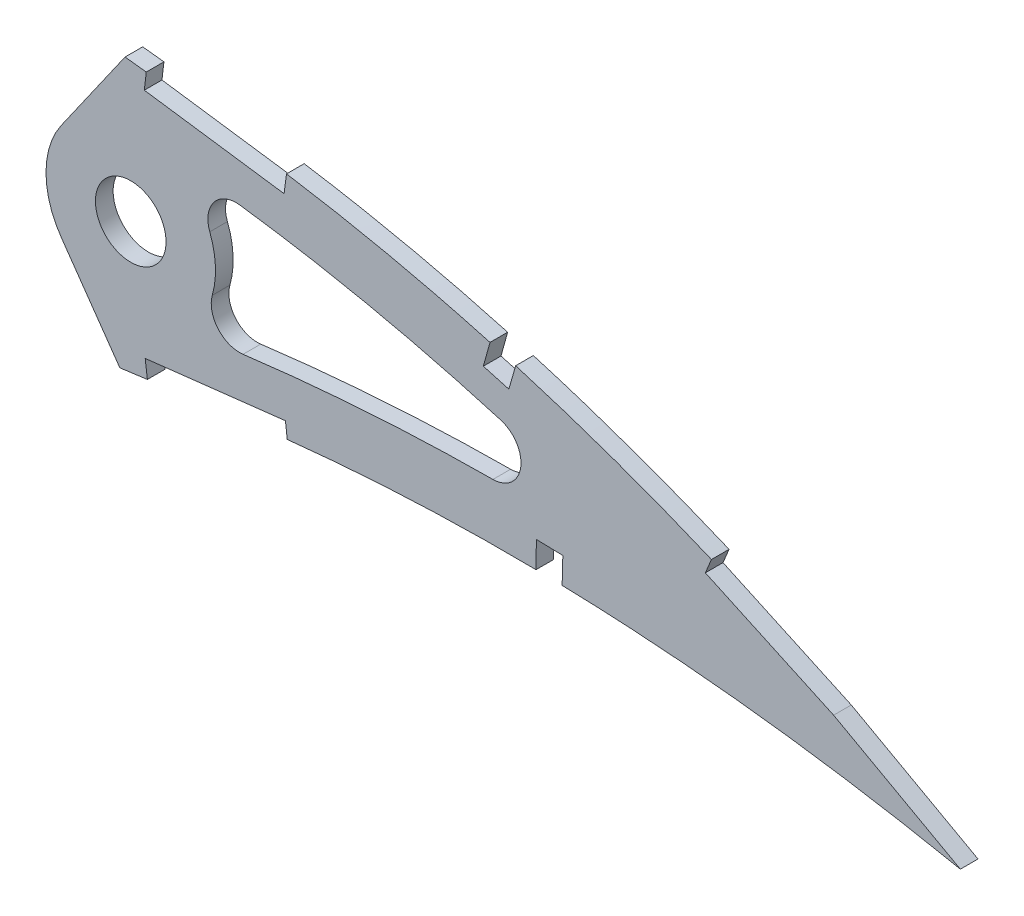
from build123d import *

# Parameters (mm, degrees)
BOSS_EXTRUDE1_DEPTH     = 3.175
SKETCH3_R               = 6.35
CUT_EXTRUDE2_DEPTH      = 7.62
CUT_EXTRUDE3_DEPTH      = 460.680430564
CUT_EXTRUDE3_DEPTH_BACK = 460.680430564
CUT_EXTRUDE4_DEPTH      = 459.987889409
FILLET1_R               = 5.08


with BuildPart() as part:
    # Sketch1 → Boss-Extrude1 (new body)
    with BuildSketch(Plane.XY):
        with BuildLine():
            Line((452.103130844, 0.704841059), (456.093968789, -1.676407199))
            Line((456.093968789, -1.676407199), (451.539257956, -0.704841059))
            add(Edge.make_bspline(
                [(0, 0), (0.116098484, -0.548062271), (0.348829019, -1.646705608), (0.981127511, -3.228296827), (1.817312083, -4.748664111), (2.874932324, -6.203769023), (4.146956076, -7.593213852), (5.630573928, -8.918443806), (7.324330898, -10.17874635), (9.226010202, -11.373547856), (11.332849305, -12.504116729), (13.642480166, -13.569749989), (16.152796843, -14.570114683), (18.861064307, -15.503873502), (21.763971588, -16.372448625), (24.858758771, -17.173723352), (28.141906776, -17.908817596), (31.610257831, -18.575854993), (35.260032504, -19.175513209), (39.087439203, -19.707456616), (43.088549366, -20.172017908), (47.259437594, -20.568222339), (51.595978462, -20.896922095), (56.093849686, -21.158335191), (60.748685259, -21.353290574), (65.556026339, -21.481047186), (70.511164689, -21.543596642), (75.60962225, -21.541878079), (80.846411515, -21.475431763), (86.217059019, -21.347928406), (91.716411041, -21.158560481), (97.339502767, -20.909619435), (103.081262098, -20.60361064), (108.936539298, -20.241571378), (114.900181528, -19.825106256), (120.967010704, -19.35755507), (127.131515672, -18.84008407), (133.388320155, -18.27570942), (139.73188498, -17.667256592), (146.156729407, -17.016651105), (152.657182369, -16.326953548), (159.227454029, -15.600398833), (165.861955098, -14.840863119), (172.554624992, -14.049720613), (179.299804335, -13.231488425), (186.0911476, -12.387729793), (192.922975871, -11.521694689), (199.789144556, -10.637460813), (206.683225759, -9.734927313), (213.599421065, -8.820524357), (220.53106073, -7.893498895), (227.472111233, -6.958618548), (234.416147314, -6.018789286), (241.356405409, -5.07430035), (248.28678484, -4.129065861), (255.200856388, -3.185680808), (262.091847615, -2.244231265), (268.953524037, -1.309396646), (275.778976202, -0.38106275), (282.561910312, 0.538888344), (289.295826346, 1.447710664), (295.974371147, 2.344257157), (302.590655451, 3.227960607), (309.138022785, 4.099152889), (315.511866205, 4.931391047), (321.69553077, 5.768992271), (327.709854245, 6.4556395), (333.649291775, 7.04171769), (339.520012945, 7.522220911), (345.31496828, 7.904062197), (351.027518107, 8.189969928), (356.650854245, 8.383935735), (362.17787359, 8.491713952), (367.601672755, 8.516039607), (372.914848341, 8.464670411), (378.110490176, 8.34174704), (383.181346836, 8.152787103), (388.120344083, 7.904165623), (392.920466429, 7.60266025), (397.574507523, 7.252718477), (402.075982121, 6.8625098), (406.417945063, 6.437746476), (410.593729281, 5.983281443), (414.597241701, 5.508637621), (418.422074216, 5.016940024), (422.062473684, 4.516268978), (425.512580015, 4.011698392), (428.766929364, 3.509669922), (431.820408455, 3.014973074), (434.668085107, 2.534173613), (437.305498365, 2.071763811), (439.728071725, 1.632259415), (441.932444373, 1.221205742), (443.914262697, 0.840644737), (445.670876088, 0.49684807), (447.199018295, 0.19133282), (448.496449148, -0.071596745), (449.560902928, -0.290902855), (450.390762879, -0.462985534), (450.984389878, -0.5881196), (451.34114184, -0.662580877), (451.499651332, -0.696392563), (451.539257956, -0.704841059)],
                knots=[0, 0, 0, 0, 0.003638255, 0.007293231, 0.011028136, 0.014901081, 0.018963272, 0.023258475, 0.027820626, 0.032679082, 0.03785316, 0.043361875, 0.049214679, 0.055422346, 0.061988786, 0.068918036, 0.076211157, 0.083868392, 0.091887411, 0.100265912, 0.108999867, 0.118084529, 0.127514843, 0.13728527, 0.147387917, 0.157816481, 0.168563473, 0.179619128, 0.190977373, 0.202626974, 0.214560478, 0.226767249, 0.239236417, 0.251959004, 0.264923894, 0.278119703, 0.291536035, 0.30516028, 0.318980685, 0.332985499, 0.34716279, 0.361498603, 0.375980747, 0.390597192, 0.405332593, 0.420174823, 0.435109533, 0.450124276, 0.465203068, 0.480333154, 0.495500583, 0.510689775, 0.525887334, 0.541078314, 0.556247233, 0.571381785, 0.58646604, 0.601484515, 0.616424329, 0.631269423, 0.646006524, 0.660620684, 0.675098187, 0.689422858, 0.703581825, 0.716907563, 0.730009274, 0.742952128, 0.755725557, 0.768319951, 0.780724337, 0.792926528, 0.804916041, 0.816679084, 0.828203525, 0.8394749, 0.850481359, 0.861207697, 0.871639326, 0.881763414, 0.891563605, 0.901027365, 0.910138977, 0.918883977, 0.927249278, 0.935221104, 0.942784739, 0.949928188, 0.956638465, 0.962904203, 0.968712288, 0.974054485, 0.978918432, 0.983297219, 0.987180246, 0.990560674, 0.993433357, 0.995790626, 0.997629588, 0.998945816, 0.999736592, 1, 1, 1, 1], degree=3))
            add(Edge.make_bspline(
                [(452.103130844, 0.704841059), (452.068496813, 0.726236426), (451.930095213, 0.811734792), (451.618251437, 1.003015711), (451.098966561, 1.321603382), (450.372013154, 1.765285304), (449.437955605, 2.332883088), (448.296324058, 3.020422222), (446.947831268, 3.825669225), (445.392803438, 4.744815234), (443.631400049, 5.773556989), (441.66429165, 6.907726386), (439.491649667, 8.140902925), (437.114315549, 9.468047233), (434.533105048, 10.882848063), (431.748506266, 12.378914822), (428.761516485, 13.948638114), (425.573282246, 15.58526602), (422.184384898, 17.279761053), (418.59642206, 19.025070833), (414.810589229, 20.812493246), (410.828178709, 22.632492429), (406.65147817, 24.477648573), (402.281642423, 26.336490908), (397.721161703, 28.200965635), (392.971977542, 30.06046153), (388.036901986, 31.906510246), (382.917838926, 33.727152381), (377.618614974, 35.514431666), (372.141800823, 37.256737501), (366.491313143, 38.944607324), (360.670434952, 40.56709799), (354.684018662, 42.115888344), (348.535860801, 43.579699531), (342.231172339, 44.948733274), (335.774964791, 46.214747245), (329.172652762, 47.36510198), (322.442531978, 48.398900537), (315.692888447, 49.25884604), (308.957131835, 50.102255317), (302.231406377, 50.894561333), (295.423478513, 51.653303868), (288.539897863, 52.374211064), (281.587492313, 53.055028822), (274.573300246, 53.692818583), (267.504610588, 54.285710178), (260.388263375, 54.830343915), (253.231762389, 55.325880728), (246.04218283, 55.767964282), (238.827182474, 56.156262652), (231.594085468, 56.488067665), (224.350419046, 56.761093174), (217.103874943, 56.973690929), (209.861975326, 57.123824182), (202.632561324, 57.210549036), (195.423152651, 57.231495803), (188.241586793, 57.186289729), (181.095384018, 57.073378669), (173.992389816, 56.89121691), (166.940134698, 56.63946441), (159.9462446, 56.318230463), (153.018377106, 55.924824851), (146.164047723, 55.461754745), (139.39088931, 54.92707481), (132.706343647, 54.320642895), (126.117416199, 53.644986873), (119.631442696, 52.898268934), (113.255374135, 52.082613865), (106.996184656, 51.199620764), (100.86089724, 50.248808671), (94.856084142, 49.232924024), (88.98822628, 48.153006108), (83.263531815, 47.012221039), (77.688233433, 45.810866329), (72.268232878, 44.552545746), (67.009162956, 43.23945158), (61.916677035, 41.873987713), (56.99593741, 40.459430694), (52.251920045, 38.998989643), (47.690155321, 37.494269359), (43.314090924, 35.950975056), (39.129102409, 34.370202293), (35.138395613, 32.756820932), (31.346647327, 31.113033952), (27.756690145, 29.443852436), (24.372587071, 27.751176724), (21.196749975, 26.039749097), (18.232367129, 24.312193837), (15.482292083, 22.571719722), (12.9476807, 20.82274152), (10.632027491, 19.066357057), (8.536127933, 17.307004609), (6.661308341, 15.547363257), (5.010248609, 13.788645116), (3.582889331, 12.033947283), (2.381101114, 10.284659424), (1.405092396, 8.542436815), (0.657070826, 6.808544998), (0.13629461, 5.083959089), (-0.148774805, 3.371224525), (-0.21973029, 1.668968236), (-0.073133992, 0.555491501), (0, 0)],
                knots=[0, 0, 0, 0, 0.00025409, 0.001015373, 0.002283359, 0.004056577, 0.006330982, 0.009105274, 0.012374489, 0.016134023, 0.02037966, 0.025105976, 0.030306237, 0.035972206, 0.042099522, 0.048678064, 0.055701664, 0.063160184, 0.071045824, 0.079349826, 0.08806291, 0.097175756, 0.106678112, 0.116561573, 0.126814275, 0.137428301, 0.148393618, 0.15969976, 0.171338126, 0.183297699, 0.195569604, 0.208143556, 0.221011593, 0.234161831, 0.24758745, 0.261276822, 0.27522271, 0.289414144, 0.303771199, 0.317689227, 0.331784111, 0.346039677, 0.36044387, 0.37498272, 0.389640454, 0.404403316, 0.419256601, 0.434186749, 0.449177265, 0.464214782, 0.479284009, 0.49436974, 0.509457833, 0.524532346, 0.53957932, 0.554582984, 0.569529546, 0.584403417, 0.599190992, 0.613876838, 0.628447475, 0.642888675, 0.657186054, 0.671325546, 0.685294014, 0.699078147, 0.712665095, 0.726042645, 0.739197713, 0.752117586, 0.764792042, 0.777208152, 0.789355685, 0.80122396, 0.812803686, 0.824082909, 0.835054602, 0.845709571, 0.856037853, 0.866033834, 0.875688843, 0.884997719, 0.893953426, 0.902552897, 0.910789386, 0.918660734, 0.926166253, 0.933302626, 0.94007122, 0.94647478, 0.952517526, 0.958204819, 0.963546652, 0.9685566, 0.973249913, 0.977651041, 0.981787043, 0.985694226, 0.989415109, 0.993001157, 0.996508416, 1, 1, 1, 1], degree=3))
        make_face()
    extrude(amount=BOSS_EXTRUDE1_DEPTH)

    # Sketch3 → Cut-Extrude2 (cut)
    with BuildSketch(Plane(origin=(0, 0, 0), x_dir=(-1, 0, 0), z_dir=(0, 0, -1))):
        with Locations((-299.038447077, 26.255421435)):
            Circle(SKETCH3_R)
    extrude(amount=-CUT_EXTRUDE2_DEPTH, mode=Mode.SUBTRACT)

    # Sketch4 → Cut-Extrude3 (cut, two sides: drawn at the far end of the back side and taken through both)
    with BuildSketch(Plane.XY.offset(3.175).offset(-CUT_EXTRUDE3_DEPTH_BACK)):
        with BuildLine():
            ThreePointArc((286.554569922, 17.514116545), (283.798447077, 26.255421435), (286.554569922, 34.996726325))
            Line((286.554569922, 34.996726325), (291.360999499, 41.861019145))
            Line((291.360999499, 41.861019145), (298.013920258, 51.362374666))
            add(Edge.make_bspline(
                [(298.013920258, 51.362374666), (297.158172729, 51.45702442), (294.008181803, 51.801525794), (288.539897863, 52.374211064), (281.587492313, 53.055028822), (274.573300246, 53.692818583), (267.504610588, 54.285710178), (260.388263375, 54.830343915), (253.231762389, 55.325880728), (246.04218283, 55.767964282), (238.827182474, 56.156262652), (231.594085468, 56.488067665), (224.350419046, 56.761093174), (217.103874943, 56.973690929), (209.861975326, 57.123824182), (202.632561324, 57.210549036), (195.423152651, 57.231495803), (188.241586793, 57.186289729), (181.095384018, 57.073378669), (173.992389816, 56.89121691), (166.940134698, 56.63946441), (159.9462446, 56.318230463), (154.912407449, 56.032379184), (152.210390737, 55.861831716), (151.817548324, 55.836670076)],
                knots=[0.340665949, 0.340665949, 0.340665949, 0.340665949, 0.346039677, 0.36044387, 0.37498272, 0.389640454, 0.404403316, 0.419256601, 0.434186749, 0.449177265, 0.464214782, 0.479284009, 0.49436974, 0.509457833, 0.524532346, 0.53957932, 0.554582984, 0.569529546, 0.584403417, 0.599190992, 0.613876838, 0.628447475, 0.642888675, 0.645345618, 0.645345618, 0.645345618, 0.645345618], degree=3))
            add(Edge.make_bspline(
                [(151.817548324, 55.836670076), (149.924372746, 55.715411774), (145.771614423, 55.430775666), (139.39088931, 54.92707481), (132.706343647, 54.320642895), (126.117416199, 53.644986873), (119.631442696, 52.898268934), (113.255374135, 52.082613865), (106.996184656, 51.199620764), (100.86089724, 50.248808671), (94.856084142, 49.232924024), (88.98822628, 48.153006108), (83.263531815, 47.012221039), (77.688233433, 45.810866329), (72.268232878, 44.552545746), (67.009162956, 43.23945158), (61.916677035, 41.873987713), (56.99593741, 40.459430694), (52.251920045, 38.998989643), (47.690155321, 37.494269359), (43.314090924, 35.950975056), (39.129102409, 34.370202293), (35.138395613, 32.756820932), (31.346647327, 31.113033952), (27.756690145, 29.443852436), (24.372587071, 27.751176724), (21.196749975, 26.039749097), (18.232367129, 24.312193837), (15.482292083, 22.571719722), (12.9476807, 20.82274152), (10.632027491, 19.066357057), (8.536127933, 17.307004609), (6.661308341, 15.547363257), (5.010248609, 13.788645116), (3.582889331, 12.033947283), (2.381101114, 10.284659424), (1.405092396, 8.542436815), (0.657070826, 6.808544998), (0.13629461, 5.083959089), (-0.148774805, 3.371224525), (-0.21973029, 1.668968236), (-0.073133992, 0.555491501), (0, 0)],
                knots=[0.645345618, 0.645345618, 0.645345618, 0.645345618, 0.657186054, 0.671325546, 0.685294014, 0.699078147, 0.712665095, 0.726042645, 0.739197713, 0.752117586, 0.764792042, 0.777208152, 0.789355685, 0.80122396, 0.812803686, 0.824082909, 0.835054602, 0.845709571, 0.856037853, 0.866033834, 0.875688843, 0.884997719, 0.893953426, 0.902552897, 0.910789386, 0.918660734, 0.926166253, 0.933302626, 0.94007122, 0.94647478, 0.952517526, 0.958204819, 0.963546652, 0.9685566, 0.973249913, 0.977651041, 0.981787043, 0.985694226, 0.989415109, 0.993001157, 0.996508416, 1, 1, 1, 1], degree=3))
            add(Edge.make_bspline(
                [(0, 0), (0.116098484, -0.548062271), (0.348829019, -1.646705608), (0.981127511, -3.228296827), (1.817312083, -4.748664111), (2.874932324, -6.203769023), (4.146956076, -7.593213852), (5.630573928, -8.918443806), (7.324330898, -10.17874635), (9.226010202, -11.373547856), (11.332849305, -12.504116729), (13.642480166, -13.569749989), (16.152796843, -14.570114683), (18.861064307, -15.503873502), (21.763971588, -16.372448625), (24.858758771, -17.173723352), (28.141906776, -17.908817596), (31.610257831, -18.575854993), (35.260032504, -19.175513209), (39.087439203, -19.707456616), (43.088549366, -20.172017908), (47.259437594, -20.568222339), (51.595978462, -20.896922095), (56.093849686, -21.158335191), (60.748685259, -21.353290574), (65.556026339, -21.481047186), (70.511164689, -21.543596642), (75.60962225, -21.541878079), (80.846411515, -21.475431763), (86.217059019, -21.347928406), (91.716411041, -21.158560481), (97.339502767, -20.909619435), (103.081262098, -20.60361064), (108.936539298, -20.241571378), (114.900181528, -19.825106256), (120.967010704, -19.35755507), (127.131515672, -18.84008407), (133.388320155, -18.27570942), (139.73188498, -17.667256592), (146.156729407, -17.016651105), (152.657182369, -16.326953548), (159.227454029, -15.600398833), (164.423185784, -15.00557734), (167.428285856, -14.653970639), (168.221856304, -14.560625117)],
                knots=[0, 0, 0, 0, 0.003638255, 0.007293231, 0.011028136, 0.014901081, 0.018963272, 0.023258475, 0.027820626, 0.032679082, 0.03785316, 0.043361875, 0.049214679, 0.055422346, 0.061988786, 0.068918036, 0.076211157, 0.083868392, 0.091887411, 0.100265912, 0.108999867, 0.118084529, 0.127514843, 0.13728527, 0.147387917, 0.157816481, 0.168563473, 0.179619128, 0.190977373, 0.202626974, 0.214560478, 0.226767249, 0.239236417, 0.251959004, 0.264923894, 0.278119703, 0.291536035, 0.30516028, 0.318980685, 0.332985499, 0.34716279, 0.361498603, 0.375980747, 0.381177933, 0.381177933, 0.381177933, 0.381177933], degree=3))
            add(Edge.make_bspline(
                [(168.221856304, -14.560625117), (169.660104846, -14.391447873), (173.347852421, -13.953497195), (179.299804335, -13.231488425), (186.0911476, -12.387729793), (192.922975871, -11.521694689), (199.789144556, -10.637460813), (206.683225759, -9.734927313), (213.599421065, -8.820524357), (220.53106073, -7.893498895), (227.472111233, -6.958618548), (234.416147314, -6.018789286), (241.356405409, -5.07430035), (248.28678484, -4.129065861), (255.200856388, -3.185680808), (262.091847615, -2.244231265), (268.953524037, -1.309396646), (275.778976202, -0.38106275), (282.561910312, 0.538888344), (289.295826346, 1.447710664), (294.127893032, 2.096380782), (296.714481339, 2.44258854), (297.074078933, 2.490700718)],
                knots=[0.381177933, 0.381177933, 0.381177933, 0.381177933, 0.390597192, 0.405332593, 0.420174823, 0.435109533, 0.450124276, 0.465203068, 0.480333154, 0.495500583, 0.510689775, 0.525887334, 0.541078314, 0.556247233, 0.571381785, 0.58646604, 0.601484515, 0.616424329, 0.631269423, 0.646006524, 0.660620684, 0.662980449, 0.662980449, 0.662980449, 0.662980449], degree=3))
            Line((297.074078933, 2.490700718), (290.512280083, 11.861920667))
            Line((290.512280083, 11.861920667), (286.554569922, 17.514116545))
        make_face()
        with BuildLine():
            add(Edge.make_bspline(
                [(397.099522024, 17.473424975), (391.104870759, 19.944342333), (379.177241568, 24.454975752), (361.031599335, 30.108120681), (345.827122006, 33.867334113), (333.567983327, 36.314328103), (325.822177912, 37.620830237), (319.688308692, 38.50590344), (314.963719571, 39.109215878), (310.159271505, 39.713456799), (306.795732769, 40.122713606), (305.012513563, 40.334581661), (304.815814132, 40.357890364)],
                knots=[0.119621685, 0.119621685, 0.119621685, 0.119621685, 0.161336405, 0.201670506, 0.242004607, 0.262171657, 0.282338708, 0.292422233, 0.302505759, 0.312589284, 0.322672809, 0.323922714, 0.323922714, 0.323922714, 0.323922714], degree=3))
            ThreePointArc((304.815814132, 40.357890364), (311.693577932, 34.746903228), (314.278447077, 26.255421435))
            ThreePointArc((314.278447077, 26.255421435), (312.737622507, 19.577832608), (308.426715772, 14.250505321))
            add(Edge.make_bspline(
                [(308.426715772, 14.250505321), (309.883764278, 14.442106028), (312.813862177, 14.824905538), (317.172571012, 15.411601995), (321.750889037, 16.002865885), (327.831130307, 16.688761643), (335.429886376, 17.415497246), (347.62570179, 18.27521734), (362.899139077, 18.793639217), (380.425060388, 18.544010551), (391.813646799, 17.883889315), (397.099522024, 17.473424975)],
                knots=[0.690710776, 0.690710776, 0.690710776, 0.690710776, 0.700258061, 0.709927156, 0.719596251, 0.729265346, 0.748603535, 0.767941725, 0.806618104, 0.845294483, 0.878913441, 0.878913441, 0.878913441, 0.878913441], degree=3))
        make_face()
    extrude(amount=CUT_EXTRUDE3_DEPTH + CUT_EXTRUDE3_DEPTH_BACK, mode=Mode.SUBTRACT)

    # Sketch5 → Cut-Extrude4 (cut, through all)
    with BuildSketch(Plane.XY.offset(3.175)):
        with BuildLine():
            add(Edge.make_bspline(
                [(307.959300125, 50.214688749), (306.058923831, 50.443506309), (304.01571842, 50.683216606), (301.971854133, 50.917122235), (301.829686497, 50.933363768)],
                knots=[0.319837191, 0.319837191, 0.319837191, 0.319837191, 0.331784111, 0.332677221, 0.332677221, 0.332677221, 0.332677221], degree=3))
            Line((301.829686497, 50.933363768), (301.47482345, 47.924910023))
            Line((301.47482345, 47.924910023), (326.610444398, 44.375507873))
            Line((326.610444398, 44.375507873), (327.027010314, 47.522970534))
            Line((327.027010314, 47.522970534), (307.959300125, 50.214688749))
        make_face()
        with BuildLine():
            add(Edge.make_bspline(
                [(327.049592603, 47.682939934), (325.523118102, 47.922682111), (321.719757816, 48.490986347), (315.692888447, 49.25884604), (310.85639105, 49.864441967), (308.300973051, 50.173549126), (307.959300125, 50.214688749)],
                knots=[0.279770165, 0.279770165, 0.279770165, 0.279770165, 0.289414144, 0.303771199, 0.317689227, 0.319837191, 0.319837191, 0.319837191, 0.319837191], degree=3))
            Line((307.959300125, 50.214688749), (327.027010314, 47.522970534))
            Line((327.027010314, 47.522970534), (327.049592603, 47.682939934))
        make_face()
        with BuildLine():
            Line((367.027712556, 34.144621107), (368.258765586, 38.409847596))
            add(Edge.make_bspline(
                [(368.258765586, 38.409847596), (367.683881505, 38.57934129), (366.146716026, 39.027931219), (364.606254541, 39.465110892), (363.641136877, 39.734202803)],
                knots=[0.191828805, 0.191828805, 0.191828805, 0.191828805, 0.195569604, 0.201823073, 0.201823073, 0.201823073, 0.201823073], degree=3))
            Line((363.641136877, 39.734202803), (362.440286106, 35.422164031))
            Line((362.440286106, 35.422164031), (367.027712556, 34.144621107))
        make_face()
        with BuildLine():
            add(Edge.make_bspline(
                [(368.258765586, 38.409847596), (367.683881505, 38.57934129), (366.146716026, 39.027931219), (364.606254541, 39.465110892), (363.641136877, 39.734202803)],
                knots=[0.191828805, 0.191828805, 0.191828805, 0.191828805, 0.195569604, 0.201823073, 0.201823073, 0.201823073, 0.201823073], degree=3))
            Line((368.258765586, 38.409847596), (368.338561592, 38.686316626))
            Line((368.338561592, 38.686316626), (363.717829024, 40.009590483))
            Line((363.717829024, 40.009590483), (363.641136877, 39.734202803))
        make_face()
        with BuildLine():
            Line((425.430642214, 12.576588432), (447.661879929, 0.292432154))
            Line((447.661879929, 0.292432154), (448.951197548, 2.625773233))
            add(Edge.make_bspline(
                [(448.951197548, 2.625773233), (448.755531686, 2.743656873), (448.110822834, 3.131193526), (446.947831268, 3.825669225), (445.392803438, 4.744815234), (443.631400049, 5.773556989), (441.66429165, 6.907726386), (439.491649667, 8.140902925), (437.114315549, 9.468047233), (434.533105048, 10.882848063), (431.748506266, 12.378914822), (428.761516485, 13.948638114), (425.573282246, 15.58526602), (422.184384898, 17.279761053), (418.59642206, 19.025070833), (414.810589229, 20.812493246), (410.828178709, 22.632492429), (407.023956095, 24.313097649), (404.542412985, 25.374002974), (403.458420651, 25.830826449)],
                knots=[0.007679507, 0.007679507, 0.007679507, 0.007679507, 0.009105274, 0.012374489, 0.016134023, 0.02037966, 0.025105976, 0.030306237, 0.035972206, 0.042099522, 0.048678064, 0.055701664, 0.063160184, 0.071045824, 0.079349826, 0.08806291, 0.097175756, 0.106678112, 0.114020064, 0.114020064, 0.114020064, 0.114020064], degree=3))
            Line((403.458420651, 25.830826449), (402.367162905, 23.210109258))
            Line((402.367162905, 23.210109258), (425.430642214, 12.576588432))
        make_face()
        with BuildLine():
            add(Edge.make_bspline(
                [(448.951197548, 2.625773233), (448.755531686, 2.743656873), (448.110822834, 3.131193526), (446.947831268, 3.825669225), (445.392803438, 4.744815234), (443.631400049, 5.773556989), (441.66429165, 6.907726386), (439.491649667, 8.140902925), (437.114315549, 9.468047233), (434.533105048, 10.882848063), (431.748506266, 12.378914822), (428.761516485, 13.948638114), (425.573282246, 15.58526602), (422.184384898, 17.279761053), (418.59642206, 19.025070833), (414.810589229, 20.812493246), (410.828178709, 22.632492429), (407.023956095, 24.313097649), (404.542412985, 25.374002974), (403.458420651, 25.830826449)],
                knots=[0.007679507, 0.007679507, 0.007679507, 0.007679507, 0.009105274, 0.012374489, 0.016134023, 0.02037966, 0.025105976, 0.030306237, 0.035972206, 0.042099522, 0.048678064, 0.055701664, 0.063160184, 0.071045824, 0.079349826, 0.08806291, 0.097175756, 0.106678112, 0.114020064, 0.114020064, 0.114020064, 0.114020064], degree=3))
            Line((448.951197548, 2.625773233), (449.197399463, 3.071336867))
            Line((449.197399463, 3.071336867), (426.966161748, 15.355493146))
            Line((426.966161748, 15.355493146), (426.650861301, 15.507013585))
            Line((426.650861301, 15.507013585), (403.587381995, 26.140534411))
            Line((403.587381995, 26.140534411), (403.458420651, 25.830826449))
        make_face()
        with BuildLine():
            add(Edge.make_bspline(
                [(448.219794673, -0.015850812), (448.337859302, -0.039881676), (448.811017615, -0.13640631), (449.560902928, -0.290902855), (450.390762879, -0.462985534), (450.984389878, -0.5881196), (451.34114184, -0.662580877), (451.499651332, -0.696392563), (451.539257956, -0.704841059)],
                knots=[0.992649687, 0.992649687, 0.992649687, 0.992649687, 0.993433357, 0.995790626, 0.997629588, 0.998945816, 0.999736592, 1, 1, 1, 1], degree=3))
            Line((448.219794673, -0.015850812), (455.663449436, -4.128937972))
            Line((455.663449436, -4.128937972), (457.19896897, -1.350033259))
            Line((457.19896897, -1.350033259), (449.197399463, 3.071336867))
            Line((449.197399463, 3.071336867), (448.951197548, 2.625773233))
            add(Edge.make_bspline(
                [(452.103130844, 0.704841059), (452.068496813, 0.726236426), (451.930095213, 0.811734792), (451.618251437, 1.003015711), (451.098966561, 1.321603382), (450.372013154, 1.765285304), (449.633171928, 2.214256187), (449.136262949, 2.514276098), (448.951197548, 2.625773233)],
                knots=[0, 0, 0, 0, 0.00025409, 0.001015373, 0.002283359, 0.004056577, 0.006330982, 0.007679507, 0.007679507, 0.007679507, 0.007679507], degree=3))
            Line((452.103130844, 0.704841059), (456.093968789, -1.676407199))
            Line((456.093968789, -1.676407199), (451.539257956, -0.704841059))
        make_face()
        with BuildLine():
            Line((447.661879929, 0.292432154), (448.219794673, -0.015850812))
            add(Edge.make_bspline(
                [(448.219794673, -0.015850812), (448.337859302, -0.039881676), (448.811017615, -0.13640631), (449.560902928, -0.290902855), (450.390762879, -0.462985534), (450.984389878, -0.5881196), (451.34114184, -0.662580877), (451.499651332, -0.696392563), (451.539257956, -0.704841059)],
                knots=[0.992649687, 0.992649687, 0.992649687, 0.992649687, 0.993433357, 0.995790626, 0.997629588, 0.998945816, 0.999736592, 1, 1, 1, 1], degree=3))
            Line((451.539257956, -0.704841059), (456.093968789, -1.676407199))
            Line((456.093968789, -1.676407199), (452.103130844, 0.704841059))
            add(Edge.make_bspline(
                [(452.103130844, 0.704841059), (452.068496813, 0.726236426), (451.930095213, 0.811734792), (451.618251437, 1.003015711), (451.098966561, 1.321603382), (450.372013154, 1.765285304), (449.633171928, 2.214256187), (449.136262949, 2.514276098), (448.951197548, 2.625773233)],
                knots=[0, 0, 0, 0, 0.00025409, 0.001015373, 0.002283359, 0.004056577, 0.006330982, 0.007679507, 0.007679507, 0.007679507, 0.007679507], degree=3))
            Line((448.951197548, 2.625773233), (447.661879929, 0.292432154))
        make_face()
        with BuildLine():
            Line((371.976721083, 13.221010939), (371.910804417, 8.46777718))
            add(Edge.make_bspline(
                [(371.910804417, 8.46777718), (372.258392102, 8.462922138), (373.825770339, 8.438858489), (375.392984747, 8.404989851), (376.612497888, 8.372718231)],
                knots=[0.825942515, 0.825942515, 0.825942515, 0.825942515, 0.828203525, 0.836138291, 0.836138291, 0.836138291, 0.836138291], degree=3))
            Line((376.612497888, 8.372718231), (376.736806311, 13.095671175))
            Line((376.736806311, 13.095671175), (371.976721083, 13.221010939))
        make_face()
        with BuildLine():
            add(Edge.make_bspline(
                [(371.910804417, 8.46777718), (372.258392102, 8.462922138), (373.825770339, 8.438858489), (375.392984747, 8.404989851), (376.612497888, 8.372718231)],
                knots=[0.825942515, 0.825942515, 0.825942515, 0.825942515, 0.828203525, 0.836138291, 0.836138291, 0.836138291, 0.836138291], degree=3))
            Line((371.910804417, 8.46777718), (371.910691402, 8.45962764))
            Line((371.910691402, 8.45962764), (376.612300587, 8.365222))
            Line((376.612300587, 8.365222), (376.612497888, 8.372718231))
        make_face()
        with BuildLine():
            Line((327.174950672, 6.382908239), (326.857001329, 9.13788844))
            Line((326.857001329, 9.13788844), (301.631726564, 6.237117628))
            Line((301.631726564, 6.237117628), (302.02970168, 3.152611918))
            add(Edge.make_bspline(
                [(302.02970168, 3.152611918), (302.224474566, 3.178586157), (304.602276292, 3.495626748), (309.138022785, 4.099152889), (315.511866205, 4.931391047), (321.509234715, 5.743757752), (325.359106229, 6.187074289), (327.174950672, 6.382908239)],
                knots=[0.673820116, 0.673820116, 0.673820116, 0.673820116, 0.675098187, 0.689422858, 0.703581825, 0.716907563, 0.728786522, 0.728786522, 0.728786522, 0.728786522], degree=3))
        make_face()
    extrude(amount=-CUT_EXTRUDE4_DEPTH, mode=Mode.SUBTRACT)

    # Fillet1
    fillet1_edges = [part.edges().sort_by_distance(p)[0] for p in [
        (397.099522024, 17.473424975, 1.5875),
        (308.426715772, 14.250505321, 1.5875),
        (304.815814132, 40.357890364, 1.5875),
    ]]
    fillet(fillet1_edges, radius=FILLET1_R)


solid = part.part
